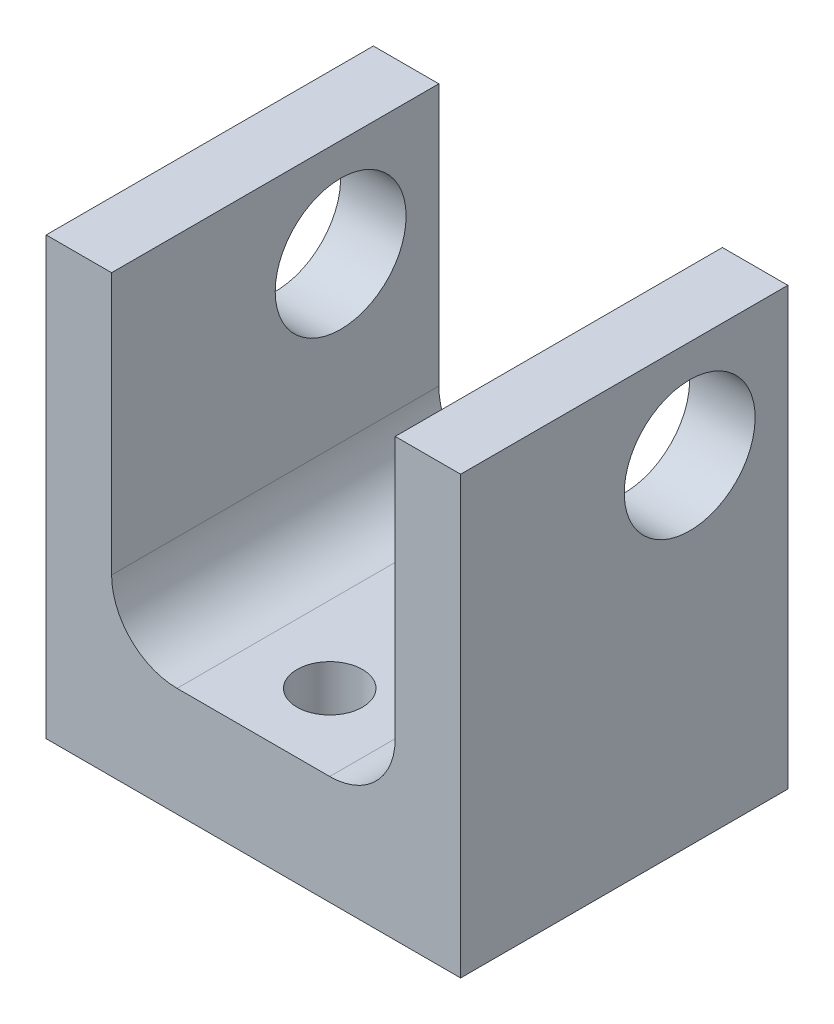
from build123d import *

# Parameters (mm, degrees)
EXTRUDE_1_DEPTH     = 15
FILLET_1_R          = 3
SKETCH_2_R          = 3
CUT_EXTRUDE_1_DEPTH = 32.400636936
SKETCH_3_R          = 1.5
CUT_EXTRUDE_2_DEPTH = 10
SKETCH_3_3_R        = 1.5
CUT_EXTRUDE_3_DEPTH = 10


with BuildPart() as part:
    # 草图1 → 凸台-拉伸1 (new body)
    with BuildSketch(Plane.XY):
        Polygon((9.5, 0), (-9.5, 0), (-9.5, 20), (-6.5, 20), (-6.5, 5), (6.5, 5), (6.5, 20), (9.5, 20), align=None)
    extrude(amount=EXTRUDE_1_DEPTH)

    # 圆角1
    fillet_1_edges = [part.edges().sort_by_distance(p)[0] for p in [
        (-6.5, 5, 7.5),
        (6.5, 5, 7.5),
    ]]
    fillet(fillet_1_edges, radius=FILLET_1_R)

    # 草图2 → 切除-拉伸1 (cut, through all)
    with BuildSketch(Plane(origin=(9.5, 0, 0), x_dir=(0, 0, -1), z_dir=(1, 0, 0))):
        with Locations((-4.5, 15.5)):
            Circle(SKETCH_2_R)
    extrude(amount=-CUT_EXTRUDE_1_DEPTH, mode=Mode.SUBTRACT)

    # 草图3 → 切除-拉伸2 (cut)
    with BuildSketch(Plane(origin=(0, 5, 0), x_dir=(1, 0, 0), z_dir=(0, 1, 0))):
        with Locations((0, -11.5)):
            Circle(SKETCH_3_R)
    extrude(amount=-CUT_EXTRUDE_2_DEPTH, mode=Mode.SUBTRACT)

    # 草图3<3> → 切除-拉伸3 (cut)
    with BuildSketch(Plane(origin=(0, 5, 0), x_dir=(1, 0, 0), z_dir=(0, 1, 0))):
        with Locations((0, -11.5)):
            Circle(SKETCH_3_3_R)
        with Locations((0, -3.5)):
            Circle(SKETCH_3_3_R)
    extrude(amount=-CUT_EXTRUDE_3_DEPTH, mode=Mode.SUBTRACT)


solid = part.part
